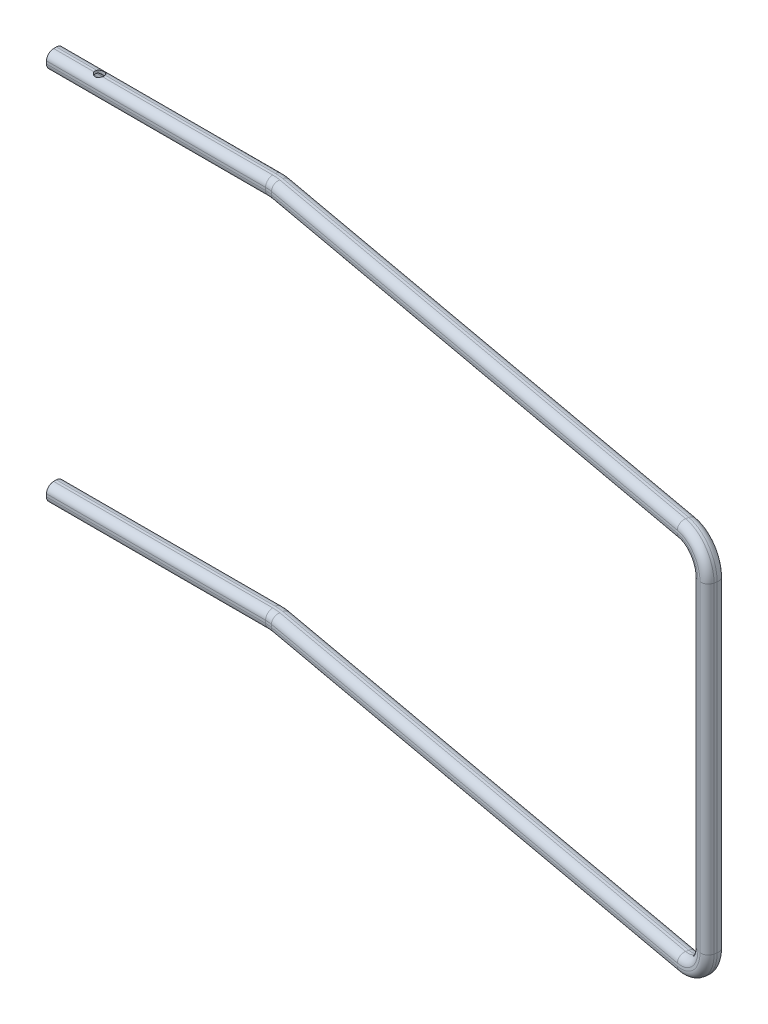
from build123d import *

# Parameters (mm, degrees)
CUT_EXTRUDE3_DEPTH      = 884.126349397
CUT_EXTRUDE3_DEPTH_BACK = 884.126349397
SKETCH21_R              = 5


with BuildPart() as part:
    # Sweep-Thin3: sweep along a curve in space
    with BuildLine() as sweep_thin3_path:
        Line((0, 0, 0), (245.482105464, 0, 0))
        ThreePointArc((254.444718845, 0, 0.80984284), (249.981668889, 0, 0.202872282), (245.482105464, 0, 0))
        Line((254.444718845, 0, 0.80984284), (810.485905704, 0, 102.122431972))
        ThreePointArc((840, -30, 107.5), (831.355521921, -8.786796564, 105.924946791), (810.485905704, 0, 102.122431972))
        Line((840, -30, 107.5), (840, -210, 107.5))
    # Sketch2 → Sweep-Thin3 (sweep)
    with BuildSketch(Plane(origin=(0, 0, 0), x_dir=(0, 0, -1), z_dir=(1, 0, 0))):
        with BuildLine():
            Line((1.5, 9.5), (-1.5, 9.5))
            ThreePointArc((-1.5, 9.5), (-7.156854249, 7.156854249), (-9.5, 1.5))
            Line((-9.5, 1.5), (-9.5, -1.5))
            ThreePointArc((-9.5, -1.5), (-7.156854249, -7.156854249), (-1.5, -9.5))
            Line((-1.5, -9.5), (1.5, -9.5))
            ThreePointArc((1.5, -9.5), (7.156854249, -7.156854249), (9.5, -1.5))
            Line((9.5, -1.5), (9.5, 1.5))
            ThreePointArc((9.5, 1.5), (7.156854249, 7.156854249), (1.5, 9.5))
        make_face()
        with BuildLine():
            Line((1.5, 6.5), (-1.5, 6.5))
            ThreePointArc((-1.5, 6.5), (-5.035533906, 5.035533906), (-6.5, 1.5))
            Line((-6.5, 1.5), (-6.5, -1.5))
            ThreePointArc((-6.5, -1.5), (-5.035533906, -5.035533906), (-1.5, -6.5))
            Line((-1.5, -6.5), (1.5, -6.5))
            ThreePointArc((1.5, -6.5), (5.035533906, -5.035533906), (6.5, -1.5))
            Line((6.5, -1.5), (6.5, 1.5))
            ThreePointArc((6.5, 1.5), (5.035533906, 5.035533906), (1.5, 6.5))
        make_face(mode=Mode.SUBTRACT)
    sweep_thin3 = sweep(path=sweep_thin3_path.line)

    # Sketch21 → Cut-Extrude3 (cut, two sides: drawn at the far end of the back side and taken through both)
    with BuildSketch(Plane(origin=(0, 0, 0), x_dir=(1, 0, 0), z_dir=(0, 1, 0)).offset(-CUT_EXTRUDE3_DEPTH_BACK)):
        with Locations(Location((50, 0, 0), (0, 0, 197.457603124))):
            Circle(SKETCH21_R)
    extrude(amount=CUT_EXTRUDE3_DEPTH + CUT_EXTRUDE3_DEPTH_BACK, mode=Mode.SUBTRACT)

    # Mirror1: Sweep-Thin3 across plane
    add(sweep_thin3.mirror(Plane(origin=(0, -210, 0), x_dir=(0, 0, 1), z_dir=(0, -1, 0))))


solid = part.part
